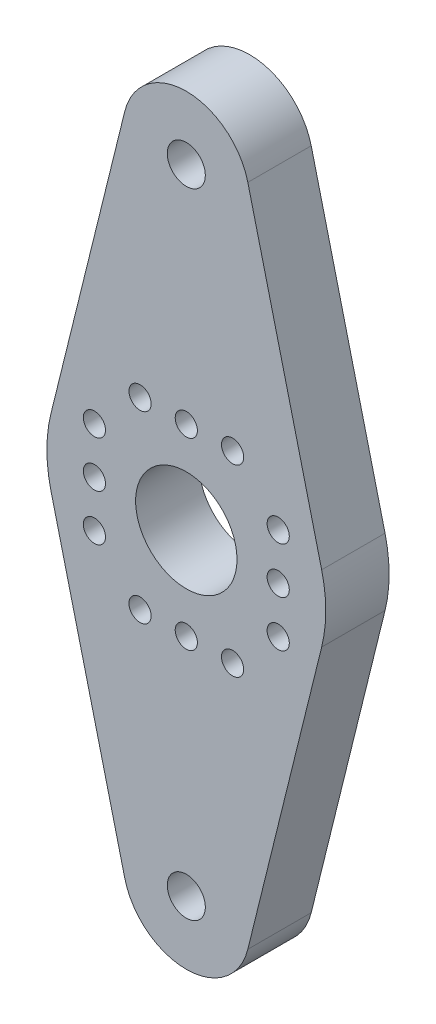
from build123d import *

# Parameters (mm, degrees)
ESQUISSE1_R        = 4
ESQUISSE1_R_2      = 0.875
ESQUISSE1_R_3      = 1.5
BOSS_EXTRU_1_DEPTH = 5


with BuildPart() as part:
    # Esquisse1 → Boss.-Extru.1 (new body)
    with BuildSketch(Plane.XY):
        with BuildLine():
            Line((-10.678501768, 2.64), (-4.85386444, 26.2))
            ThreePointArc((-4.85386444, 26.2), (0, 30), (4.85386444, 26.2))
            Line((4.85386444, 26.2), (10.678501768, 2.64))
            ThreePointArc((10.678501768, 2.64), (11, 0), (10.678501768, -2.64))
            Line((10.678501768, -2.64), (4.85386444, -26.2))
            ThreePointArc((4.85386444, -26.2), (0, -30), (-4.85386444, -26.2))
            Line((-4.85386444, -26.2), (-10.678501768, -2.64))
            ThreePointArc((-10.678501768, -2.64), (-11, 0), (-10.678501768, 2.64))
        make_face()
        Circle(ESQUISSE1_R, mode=Mode.SUBTRACT)
        with Locations((7.25, 0)):
            Circle(ESQUISSE1_R_2, mode=Mode.SUBTRACT)
        with Locations((7.25, 3.65)):
            Circle(ESQUISSE1_R_2, mode=Mode.SUBTRACT)
        with Locations(Location((7.25, -3.65, 0), (0, 0, 180))):
            Circle(ESQUISSE1_R_2, mode=Mode.SUBTRACT)
        with Locations((3.65, -7.25)):
            Circle(ESQUISSE1_R_2, mode=Mode.SUBTRACT)
        with Locations((0, -7.25)):
            Circle(ESQUISSE1_R_2, mode=Mode.SUBTRACT)
        with Locations(Location((-3.65, -7.25, 0), (0, 0, 180))):
            Circle(ESQUISSE1_R_2, mode=Mode.SUBTRACT)
        with Locations((-7.25, -3.65)):
            Circle(ESQUISSE1_R_2, mode=Mode.SUBTRACT)
        with Locations((-7.25, 0)):
            Circle(ESQUISSE1_R_2, mode=Mode.SUBTRACT)
        with Locations(Location((-7.25, 3.65, 0), (0, 0, 180))):
            Circle(ESQUISSE1_R_2, mode=Mode.SUBTRACT)
        with Locations((-3.65, 7.25)):
            Circle(ESQUISSE1_R_2, mode=Mode.SUBTRACT)
        with Locations((0, 7.25)):
            Circle(ESQUISSE1_R_2, mode=Mode.SUBTRACT)
        with Locations(Location((3.65, 7.25, 0), (0, 0, 180))):
            Circle(ESQUISSE1_R_2, mode=Mode.SUBTRACT)
        with Locations((0, 25)):
            Circle(ESQUISSE1_R_3, mode=Mode.SUBTRACT)
        with Locations(Location((0, -25, 0), (0, 0, 180))):
            Circle(ESQUISSE1_R_3, mode=Mode.SUBTRACT)
    extrude(amount=BOSS_EXTRU_1_DEPTH)


solid = part.part
